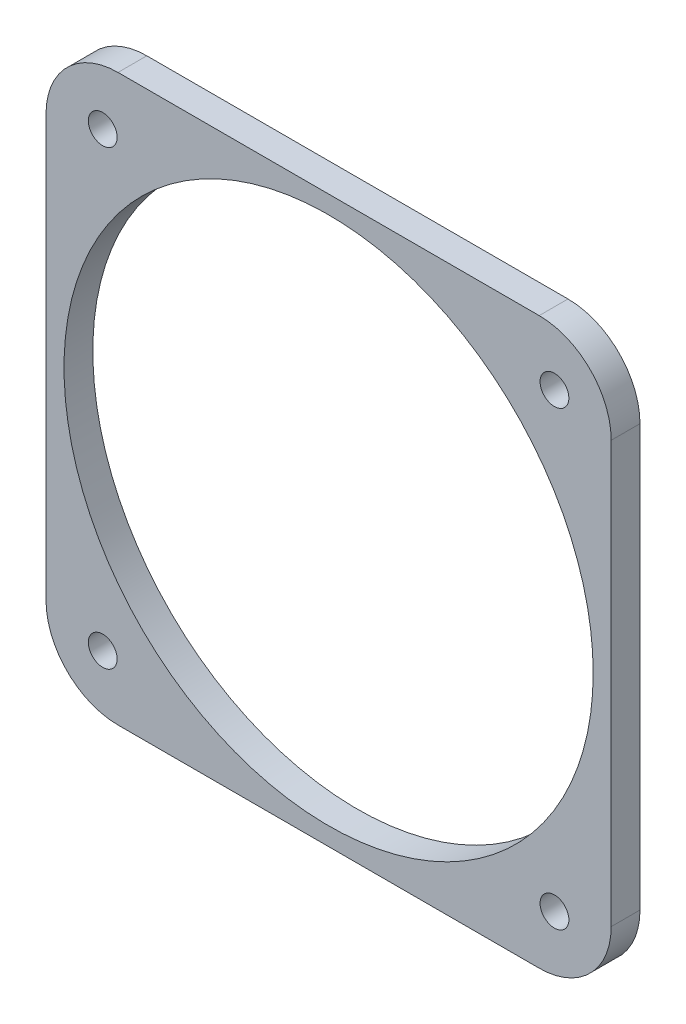
from build123d import *

# Parameters (mm, degrees)
SKETCH1_W           = 78.5
SKETCH1_H           = 78.5
BOSS_EXTRUDE1_DEPTH = 2
FILLET1_R           = 10
SKETCH2_R           = 2
CUT_EXTRUDE1_DEPTH  = 56.651819377
SKETCH3_R           = 36.75
CUT_EXTRUDE2_DEPTH  = 56.651819377


with BuildPart() as part:
    # Sketch1 → Boss-Extrude1 (new, symmetric)
    with BuildSketch(Plane.XY):
        Rectangle(SKETCH1_W, SKETCH1_H)
    extrude(amount=BOSS_EXTRUDE1_DEPTH, both=True)

    # Fillet1
    fillet1_edges = [part.edges().sort_by_distance(p)[0] for p in [
        (39.25, -39.25, 0),
        (-39.25, -39.25, 0),
        (-39.25, 39.25, 0),
        (39.25, 39.25, 0),
    ]]
    fillet(fillet1_edges, radius=FILLET1_R)

    # Sketch2 → Cut-Extrude1 (cut, through all)
    with BuildSketch(Plane.XY.offset(2)):
        with Locations((-31.371320344, 31.371320344)):
            Circle(SKETCH2_R)
        with Locations(Location((-31.371320344, -31.371320344, 0), (0, 0, 180))):
            Circle(SKETCH2_R)
        with Locations(Location((31.371320344, 31.371320344, 0), (0, 0, 180))):
            Circle(SKETCH2_R)
        with Locations((31.371320344, -31.371320344)):
            Circle(SKETCH2_R)
    extrude(amount=-CUT_EXTRUDE1_DEPTH, mode=Mode.SUBTRACT)

    # Sketch3 → Cut-Extrude2 (cut, through all)
    with BuildSketch(Plane.XY.offset(2)):
        Circle(SKETCH3_R)
    extrude(amount=-CUT_EXTRUDE2_DEPTH, mode=Mode.SUBTRACT)


solid = part.part
